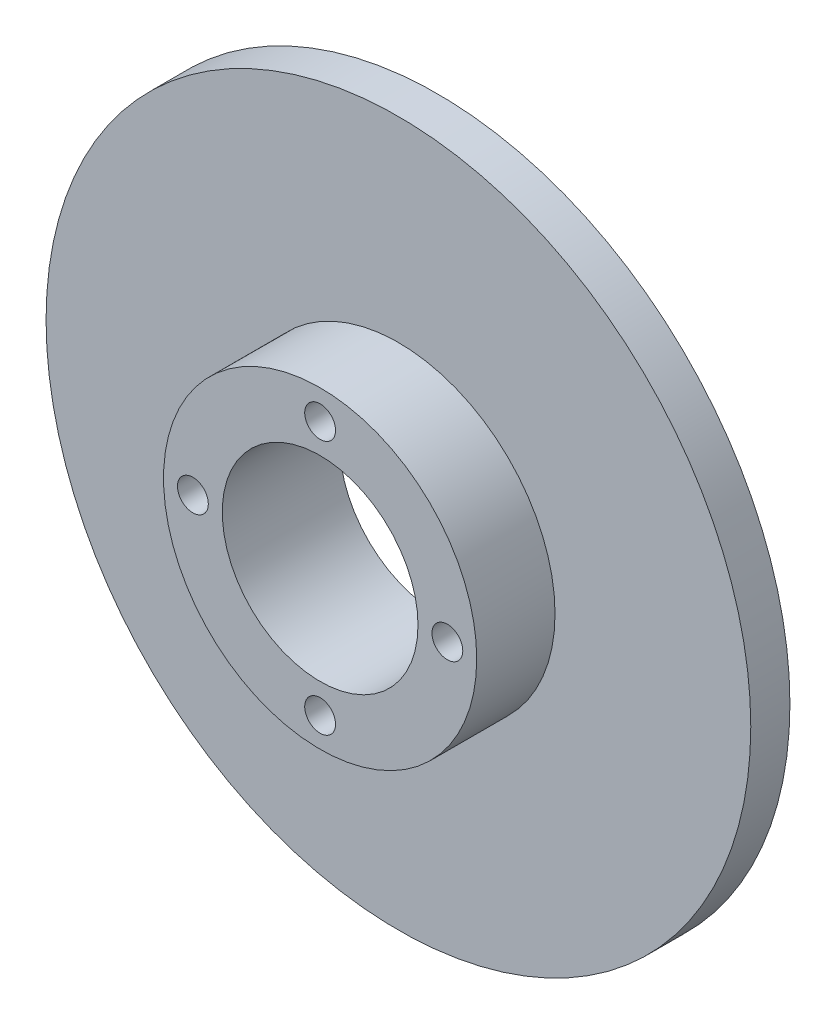
from build123d import *

# Parameters (mm, degrees)
SKETCH1_R           = 114.3
BOSS_EXTRUDE1_DEPTH = 12.7
SKETCH2_R           = 50.8
BOSS_EXTRUDE2_DEPTH = 25.4
SKETCH3_R           = 31.75
CUT_EXTRUDE1_DEPTH  = 118.11
SKETCH4_R           = 5
CUT_EXTRUDE2_DEPTH  = 118.11


with BuildPart() as part:
    # Sketch1 → Boss-Extrude1 (new body)
    with BuildSketch(Plane.XY):
        Circle(SKETCH1_R)
    extrude(amount=BOSS_EXTRUDE1_DEPTH)

    # Sketch2 → Boss-Extrude2 (add)
    with BuildSketch(Plane.XY.offset(12.7)):
        Circle(SKETCH2_R)
    extrude(amount=BOSS_EXTRUDE2_DEPTH)

    # Sketch3 → Cut-Extrude1 (cut)
    with BuildSketch(Plane.XY.offset(38.1)):
        Circle(SKETCH3_R)
    extrude(amount=-CUT_EXTRUDE1_DEPTH, mode=Mode.SUBTRACT)

    # Sketch4 → Cut-Extrude2 (cut)
    with BuildSketch(Plane.XY.offset(38.1)):
        with Locations((0, 41.275)):
            Circle(SKETCH4_R)
        with Locations((41.275, 0)):
            Circle(SKETCH4_R)
        with Locations((0, -41.275)):
            Circle(SKETCH4_R)
        with Locations((-41.275, 0)):
            Circle(SKETCH4_R)
    extrude(amount=-CUT_EXTRUDE2_DEPTH, mode=Mode.SUBTRACT)


solid = part.part
